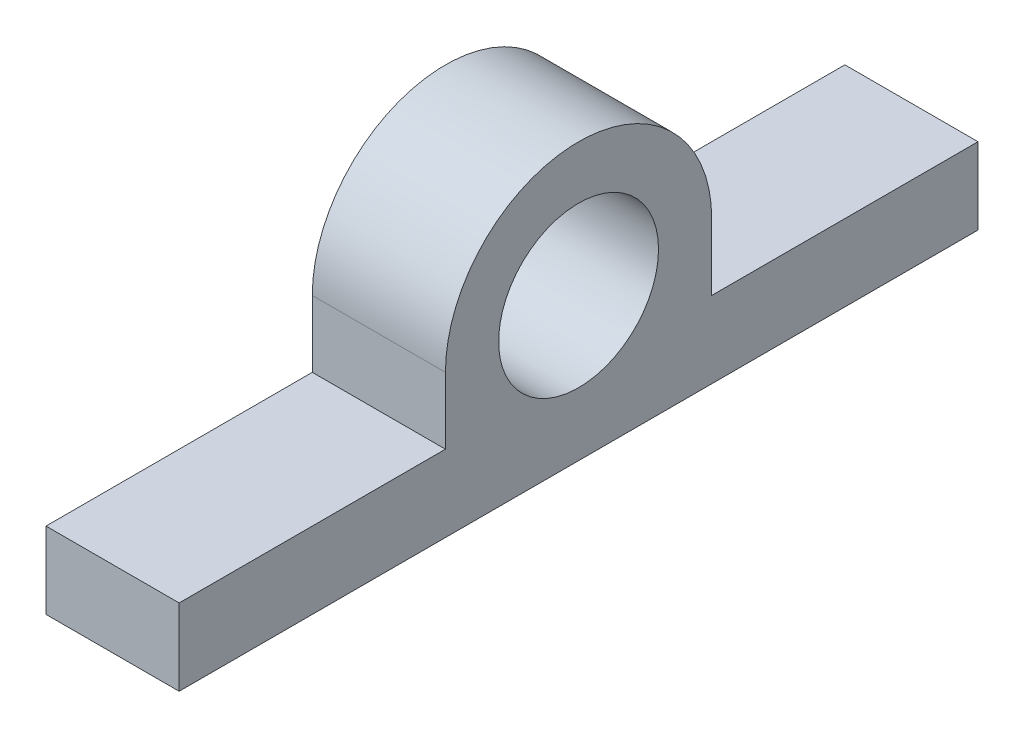
from build123d import *

# Parameters (mm, degrees)
BOSS_EXTRUDE1_DEPTH = 12.7
SKETCH2_R           = 7.62500004
CUT_EXTRUDE1_DEPTH  = 82.621397317
SKETCH3_R           = 2
CUT_EXTRUDE2_DEPTH  = 7


with BuildPart() as part:
    # Sketch1 → Boss-Extrude1 (new body)
    with BuildSketch(Plane(origin=(0, 0, 0), x_dir=(0, 0, -1), z_dir=(1, 0, 0))):
        with BuildLine():
            Line((0, 0), (76.2, 0))
            Line((76.2, 0), (76.2, 7.3))
            Line((76.2, 7.3), (50.8, 7.3))
            Line((50.8, 7.3), (50.8, 13.65))
            ThreePointArc((50.8, 13.65), (38.1, 26.35), (25.4, 13.65))
            Line((25.4, 13.65), (25.4, 7.3))
            Line((25.4, 7.3), (0, 7.3))
            Line((0, 7.3), (0, 0))
        make_face()
    extrude(amount=BOSS_EXTRUDE1_DEPTH)

    # Sketch2 → Cut-Extrude1 (cut, through all)
    with BuildSketch(Plane(origin=(12.7, 0, 0), x_dir=(0, 0, -1), z_dir=(1, 0, 0))):
        with Locations((38.1, 13.65)):
            Circle(SKETCH2_R)
    extrude(amount=-CUT_EXTRUDE1_DEPTH, mode=Mode.SUBTRACT)

    # Sketch3 → Cut-Extrude2 (cut)
    with BuildSketch(Plane.XZ):
        with Locations(Location((6.35, -12.7, 0), (0, 0, 270))):
            Circle(SKETCH3_R)
        with Locations(Location((6.35, -63.5, 0), (0, 0, 270))):
            Circle(SKETCH3_R)
    extrude(amount=-CUT_EXTRUDE2_DEPTH, mode=Mode.SUBTRACT)


solid = part.part
